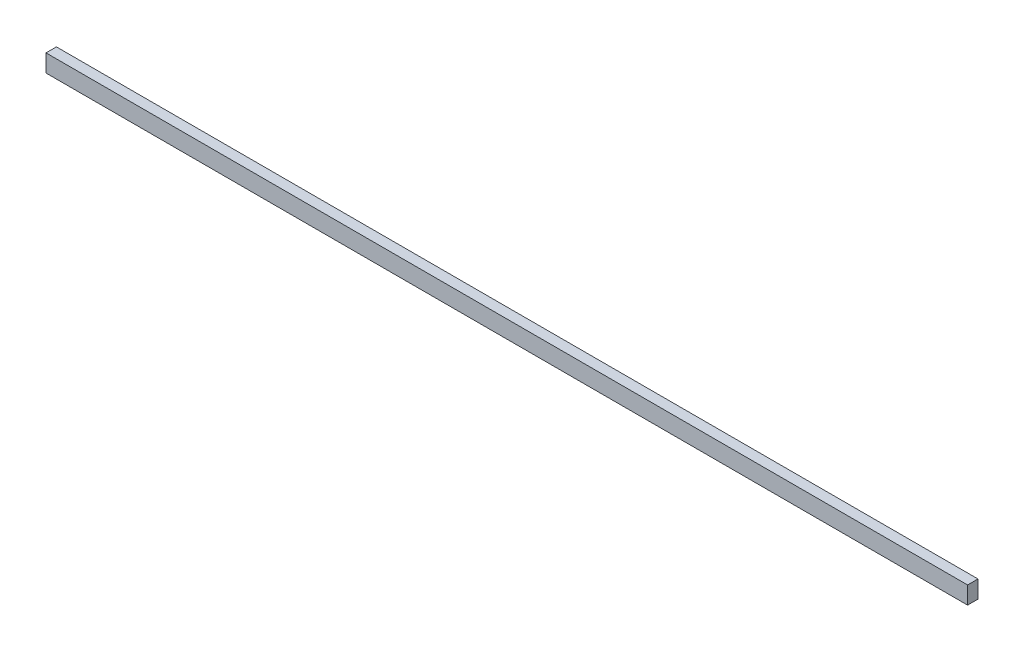
from build123d import *

# Parameters (mm, degrees)
ESQUISSE1_W        = 1950
ESQUISSE1_H        = 37
BOSS_EXTRU_1_DEPTH = 22


with BuildPart() as part:
    # Esquisse1 → Boss.-Extru.1 (new body)
    with BuildSketch(Plane.XY):
        with Locations((975, 18.5)):
            Rectangle(ESQUISSE1_W, ESQUISSE1_H)
    extrude(amount=BOSS_EXTRU_1_DEPTH)


solid = part.part
